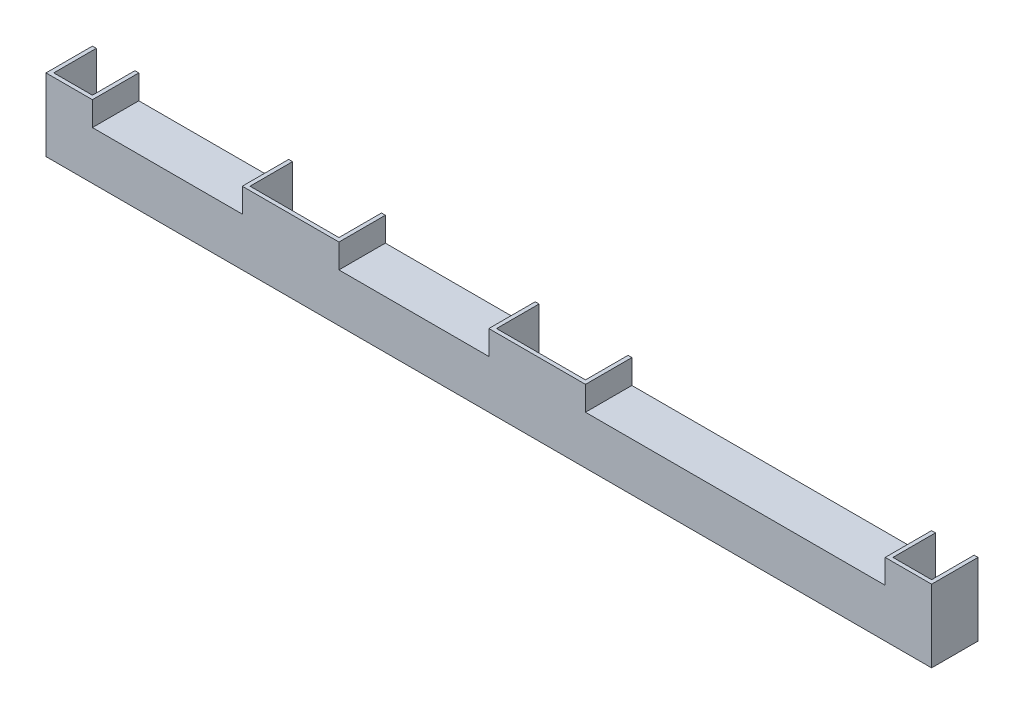
from build123d import *

# Parameters (mm, degrees)
SKETCH1_W           = 1832
SKETCH1_H           = 100
BOSS_EXTRUDE1_DEPTH = 8
SKETCH2_W           = 8
SKETCH2_H           = 100
BOSS_EXTRUDE2_DEPTH = 88
BOSS_EXTRUDE3_DEPTH = 50
SKETCH4_W           = 620
SKETCH4_H           = 8
SKETCH4_W_2         = 310
BOSS_EXTRUDE4_DEPTH = 88


with BuildPart() as part:
    # Sketch1 → Boss-Extrude1 (new body)
    with BuildSketch(Plane.XY):
        Rectangle(SKETCH1_W, SKETCH1_H)
    extrude(amount=BOSS_EXTRUDE1_DEPTH)

    # Sketch2 → Boss-Extrude2 (add)
    with BuildSketch(Plane(origin=(0, 0, 0), x_dir=(-1, 0, 0), z_dir=(0, 0, -1))):
        with Locations((-912, 0)):
            Rectangle(SKETCH2_W, SKETCH2_H)
        with Locations((912, 0)):
            Rectangle(SKETCH2_W, SKETCH2_H)
        with Locations((824, 0)):
            Rectangle(SKETCH2_W, SKETCH2_H)
        with Locations((506, 0)):
            Rectangle(SKETCH2_W, SKETCH2_H)
        with Locations((314, 0)):
            Rectangle(SKETCH2_W, SKETCH2_H)
        with Locations((-4, 0)):
            Rectangle(SKETCH2_W, SKETCH2_H)
        with Locations((-196, 0)):
            Rectangle(SKETCH2_W, SKETCH2_H)
        with Locations((-824, 0)):
            Rectangle(SKETCH2_W, SKETCH2_H)
    extrude(amount=BOSS_EXTRUDE2_DEPTH)

    # Sketch3 → Boss-Extrude3 (add)
    with BuildSketch(Plane(origin=(0, 50, 0), x_dir=(1, 0, 0), z_dir=(0, 1, 0))):
        Polygon((-916, 88), (-916, -8), (-820, -8), (-820, 88), (-828, 88), (-828, 0), (-908, 0), (-908, 88), align=None)
        Polygon((-510, 88), (-510, -8), (-310, -8), (-310, 88), (-318, 88), (-318, 0), (-502, 0), (-502, 88), align=None)
        Polygon((0, 88), (0, -8), (200, -8), (200, 88), (192, 88), (192, 0), (8, 0), (8, 88), align=None)
        Polygon((820, 88), (820, -8), (916, -8), (916, 88), (908, 88), (908, 0), (828, 0), (828, 88), align=None)
    extrude(amount=BOSS_EXTRUDE3_DEPTH)

    # Sketch4 → Boss-Extrude4 (add)
    with BuildSketch(Plane(origin=(0, 0, 0), x_dir=(-1, 0, 0), z_dir=(0, 0, -1))):
        with Locations((-510, 46)):
            Rectangle(SKETCH4_W, SKETCH4_H)
        with Locations((155, 46)):
            Rectangle(SKETCH4_W_2, SKETCH4_H)
        with Locations((665, 46)):
            Rectangle(SKETCH4_W_2, SKETCH4_H)
    extrude(amount=BOSS_EXTRUDE4_DEPTH)


solid = part.part
